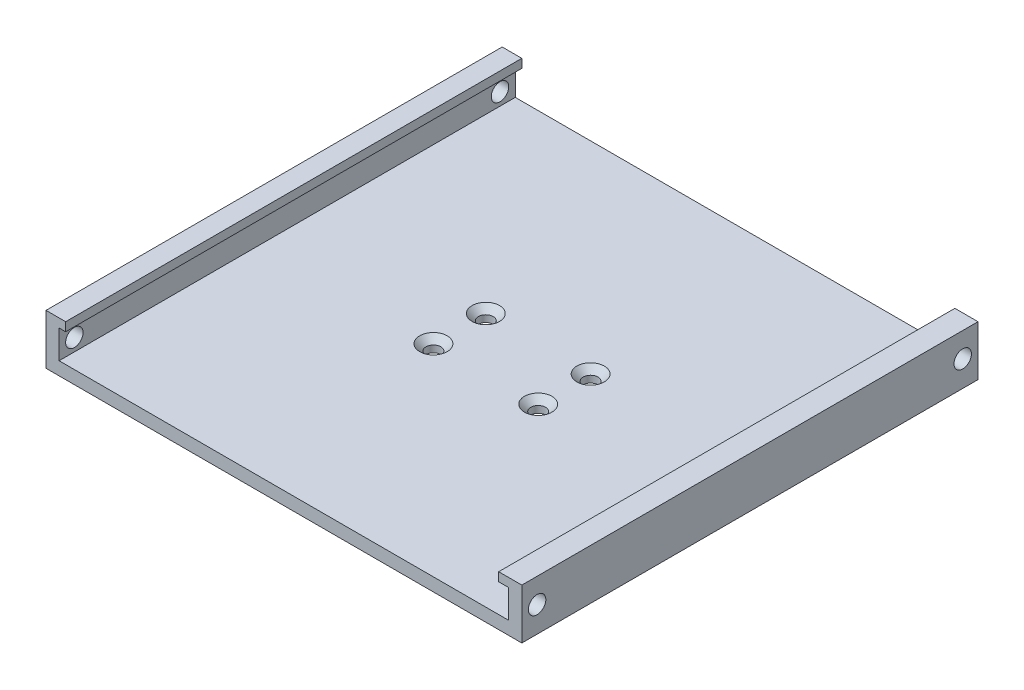
from build123d import *

# Parameters (mm, degrees)
BOSS_EXTRUDE1_DEPTH                            = 52.25
BOSS_EXTRUDE1_DEPTH_BACK                       = 52.25
CSK_FOR_M3_FLAT_HEAD_MACHINE_SCREW1_AT_2_COUNT = 2
CSK_FOR_M3_FLAT_HEAD_MACHINE_SCREW1_AT_2_PITCH = 12
CSK_FOR_M3_FLAT_HEAD_MACHINE_SCREW1_AT_3_COUNT = 2
CSK_FOR_M3_FLAT_HEAD_MACHINE_SCREW1_AT_3_PITCH = 26.83281573
CSK_FOR_M3_FLAT_HEAD_MACHINE_SCREW1_AT_4_COUNT = 2
CSK_FOR_M3_FLAT_HEAD_MACHINE_SCREW1_AT_4_PITCH = 24
SKETCH5_R                                      = 2
CUT_EXTRUDE1_DEPTH                             = 122.422042892


with BuildPart() as part:
    # Sketch1 → Boss-Extrude1 (new, two sides: drawn at the far end of the back side and taken through both)
    with BuildSketch(Plane.XY.offset(-BOSS_EXTRUDE1_DEPTH_BACK)):
        Polygon((-50, 11.5), (-50, 9.5), (-51.5, 9.5), (-51.5, 3), (51.5, 3), (51.5, 9.5), (49.2, 9.5), (49.2, 11.5), (54.5, 11.5), (54.5, 0), (-54.5, 0), (-54.5, 11.5), align=None)
    extrude(amount=BOSS_EXTRUDE1_DEPTH + BOSS_EXTRUDE1_DEPTH_BACK)

    # Sketch4 → CSK for M3 Flat Head Machine Screw1 (revolve, cut)
    with BuildSketch(Plane(origin=(-12, 3, -6), x_dir=(0, 0, 1), z_dir=(1, 0, 0))):
        Polygon((0, 0), (0, 3), (1.7, 3), (1.7, 1.45), (3.15, 0), align=None)
    csk_for_m3_flat_head_machine_screw1 = revolve(axis=Axis((-12, 9.35, -6), (0, -1, 0)), mode=Mode.SUBTRACT)

    # CSK for M3 Flat Head Machine Screw1 at 2: CSK for M3 Flat Head Machine Screw1 ×2
    with Locations(*[(0, 0, i * CSK_FOR_M3_FLAT_HEAD_MACHINE_SCREW1_AT_2_PITCH) for i in range(1, CSK_FOR_M3_FLAT_HEAD_MACHINE_SCREW1_AT_2_COUNT)]):
        add(csk_for_m3_flat_head_machine_screw1, mode=Mode.SUBTRACT)

    # CSK for M3 Flat Head Machine Screw1 at 3: CSK for M3 Flat Head Machine Screw1 ×2
    with Locations(*[Vector(0.894427190999916, 0, 0.4472135954999579) * (i * CSK_FOR_M3_FLAT_HEAD_MACHINE_SCREW1_AT_3_PITCH) for i in range(1, CSK_FOR_M3_FLAT_HEAD_MACHINE_SCREW1_AT_3_COUNT)]):
        add(csk_for_m3_flat_head_machine_screw1, mode=Mode.SUBTRACT)

    # CSK for M3 Flat Head Machine Screw1 at 4: CSK for M3 Flat Head Machine Screw1 ×2
    with Locations(*[(i * CSK_FOR_M3_FLAT_HEAD_MACHINE_SCREW1_AT_4_PITCH, 0, 0) for i in range(1, CSK_FOR_M3_FLAT_HEAD_MACHINE_SCREW1_AT_4_COUNT)]):
        add(csk_for_m3_flat_head_machine_screw1, mode=Mode.SUBTRACT)

    # Sketch5 → Cut-Extrude1 (cut, through all)
    with BuildSketch(Plane(origin=(54.5, 0, 0), x_dir=(0, 0, -1), z_dir=(1, 0, 0))):
        with Locations((-48.75, 5.875)):
            Circle(SKETCH5_R)
        with Locations((48.75, 5.875)):
            Circle(SKETCH5_R)
    extrude(amount=-CUT_EXTRUDE1_DEPTH, mode=Mode.SUBTRACT)


solid = part.part
